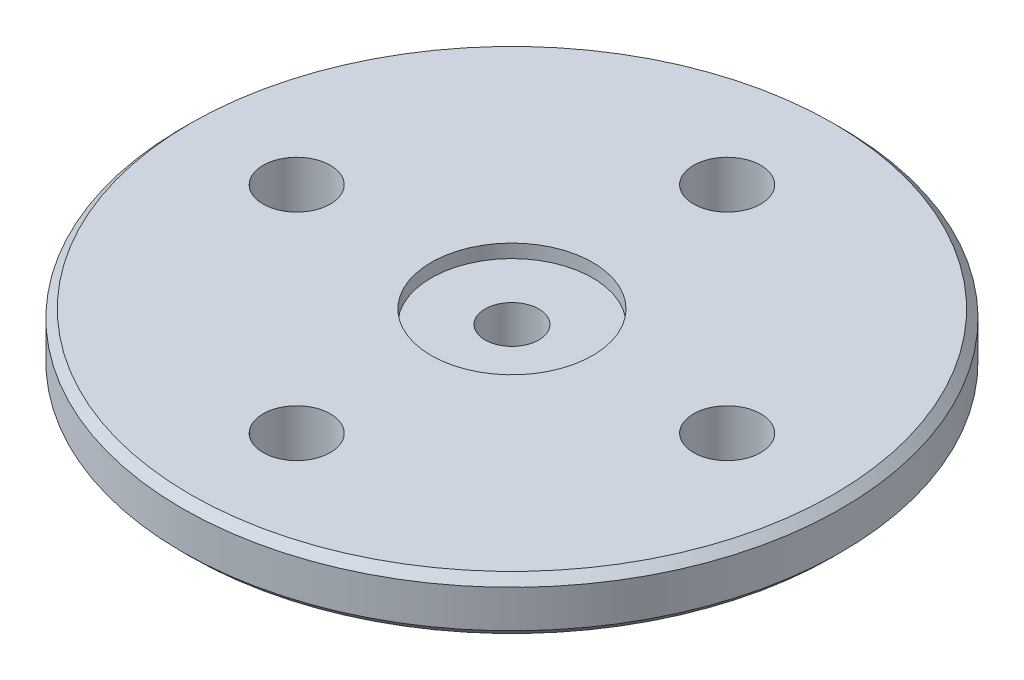
from build123d import *

# Parameters (mm, degrees)
SKETCH_1_R          = 4
SKETCH_1_R_2        = 1
EXTRUDE_1_DEPTH     = 5
EXTRUDE_START       = -2
SKETCH_2_R          = 12.25
SKETCH_2_R_2        = 4
SKETCH_2_R_3        = 1.25
EXTRUDE_2_DEPTH     = 2
CHAMFER_1_SIZE      = 0.3
SKETCH_3_R          = 3
CUT_EXTRUDE_1_DEPTH = 0.5
SKETCH_4_R          = 2.9
CUT_EXTRUDE_2_DEPTH = 3


with BuildPart() as part:
    # 草图1 → 凸台-拉伸1 (new body)
    with BuildSketch(Plane(origin=(0, 0, 0), x_dir=(1, 0, 0), z_dir=(0, 1, 0))):
        with Locations(Location((0, 0, 0), (0, 0, 270))):
            Circle(SKETCH_1_R)
        with Locations(Location((0, 0, 0), (0, 0, 270))):
            Circle(SKETCH_1_R_2, mode=Mode.SUBTRACT)
    extrude(amount=EXTRUDE_1_DEPTH)

    # 草图2 → 凸台-拉伸2 (add)
    with BuildSketch(Plane(origin=(0, 5, 0), x_dir=(1, 0, 0), z_dir=(0, 1, 0)).offset(EXTRUDE_START)):
        with Locations(Location((0, 0, 0), (0, 0, 270))):
            Circle(SKETCH_2_R)
        with Locations(Location((0, 0, 0), (0, 0, 270))):
            Circle(SKETCH_2_R_2, mode=Mode.SUBTRACT)
        with Locations(Location((0, 8, 0), (0, 0, 270))):
            Circle(SKETCH_2_R_3, mode=Mode.SUBTRACT)
        with Locations(Location((8, 0, 0), (0, 0, 270))):
            Circle(SKETCH_2_R_3, mode=Mode.SUBTRACT)
        with Locations(Location((0, -8, 0), (0, 0, 270))):
            Circle(SKETCH_2_R_3, mode=Mode.SUBTRACT)
        with Locations(Location((-8, 0, 0), (0, 0, 270))):
            Circle(SKETCH_2_R_3, mode=Mode.SUBTRACT)
    extrude(amount=EXTRUDE_2_DEPTH)

    # 倒角1
    chamfer_1_edges = [part.edges().sort_by_distance(p)[0] for p in [
        (0, 3, -12.25),
        (0, 5, -12.25),
        (0, 0, -4),
        (0, 3, -4),
    ]]
    chamfer(chamfer_1_edges, length=CHAMFER_1_SIZE)

    # 草图3 → 切除-拉伸1 (cut)
    with BuildSketch(Plane(origin=(0, 5, 0), x_dir=(1, 0, 0), z_dir=(0, 1, 0))):
        with Locations(Location((0, 0, 0), (0, 0, 270))):
            Circle(SKETCH_3_R)
    extrude(amount=-CUT_EXTRUDE_1_DEPTH, mode=Mode.SUBTRACT)

    # 草图4 → 切除-拉伸2 (cut)
    with BuildSketch(Plane.XZ):
        with Locations(Location((0, 0, 0), (0, 0, 270))):
            Circle(SKETCH_4_R)
    extrude(amount=-CUT_EXTRUDE_2_DEPTH, mode=Mode.SUBTRACT)


solid = part.part
